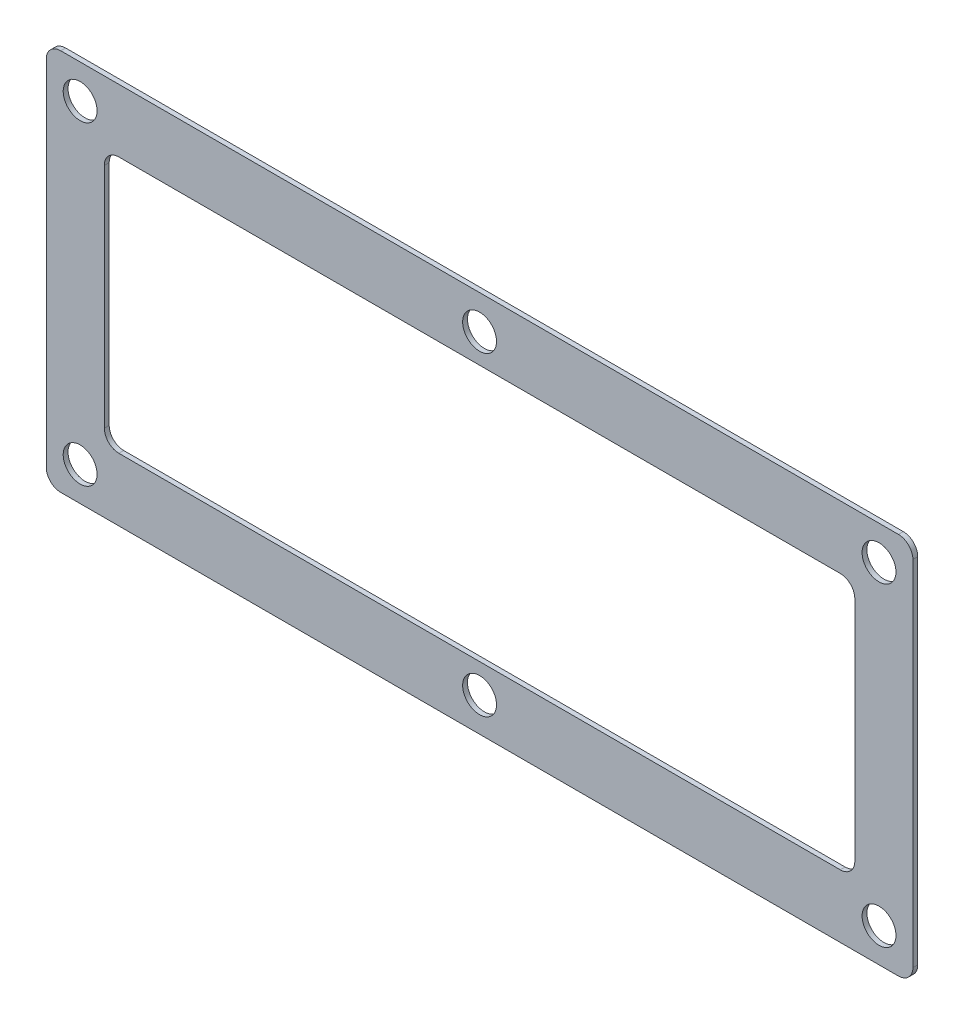
from build123d import *

# Parameters (mm, degrees)
SKETCH1_W                = 179
SKETCH1_H                = 79
BOSS_EXTRUDE1_DEPTH      = 1
FILLET1_R                = 3
F_7_0_7_DIAMETER_HOLE1_D = 7
SKETCH4_W                = 155
SKETCH4_H                = 53
CUT_EXTRUDE1_DEPTH       = 98.834043155
FILLET2_R                = 3


with BuildPart() as part:
    # Sketch1 → Boss-Extrude1 (new body)
    with BuildSketch(Plane.XY):
        Rectangle(SKETCH1_W, SKETCH1_H)
    extrude(amount=BOSS_EXTRUDE1_DEPTH)

    # Fillet1
    fillet1_edges = [part.edges().sort_by_distance(p)[0] for p in [
        (89.5, -39.5, 0.5),
        (-89.5, -39.5, 0.5),
        (-89.5, 39.5, 0.5),
        (89.5, 39.5, 0.5),
    ]]
    fillet(fillet1_edges, radius=FILLET1_R)

    # Ø7.0 (7) Diameter Hole1 (through all)
    with Locations(Plane.XY.offset(1)):
        with Locations((0, 32.5), (-82.5, 32.5), (82.5, 32.5), (82.5, -32.5), (0, -32.5), (-82.5, -32.5)):
            Hole(F_7_0_7_DIAMETER_HOLE1_D / 2)

    # Sketch4 → Cut-Extrude1 (cut, through all)
    with BuildSketch(Plane.XY.offset(1)):
        Rectangle(SKETCH4_W, SKETCH4_H)
    extrude(amount=-CUT_EXTRUDE1_DEPTH, mode=Mode.SUBTRACT)

    # Fillet2
    fillet2_edges = [part.edges().sort_by_distance(p)[0] for p in [
        (-77.5, -26.5, 0.5),
        (-77.5, 26.5, 0.5),
        (77.5, 26.5, 0.5),
        (77.5, -26.5, 0.5),
    ]]
    fillet(fillet2_edges, radius=FILLET2_R)


solid = part.part
